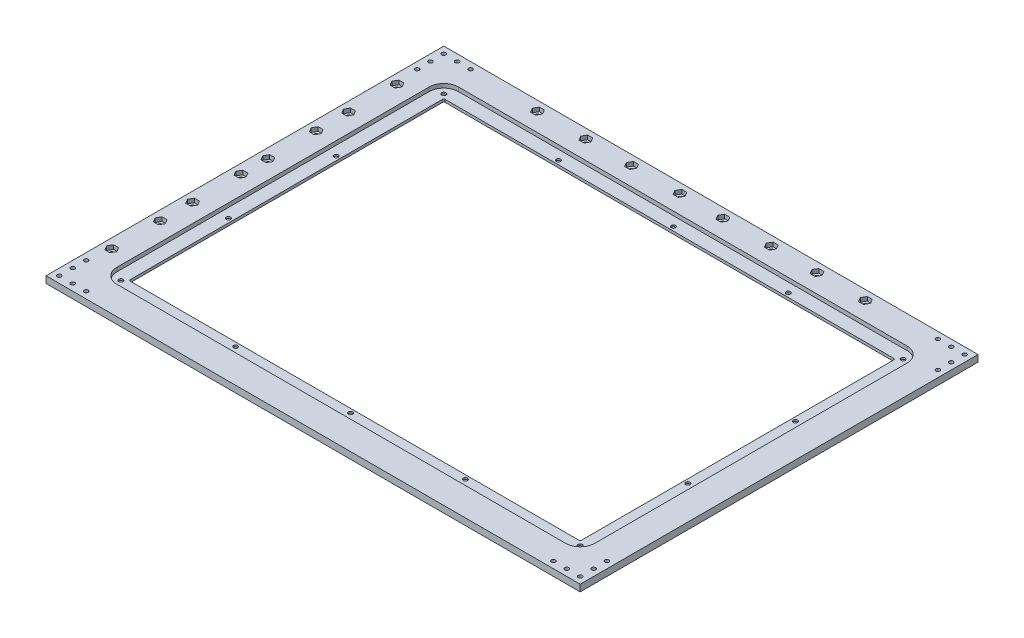
from build123d import *

# Parameters (mm, degrees)
SKETCH1_W           = 399.5
SKETCH1_H           = 297.5
BOSS_EXTRUDE1_DEPTH = 5
SKETCH2_R           = 1.6
CUT_EXTRUDE2_DEPTH  = 1.2
SKETCH3_R           = 1.5
CUT_EXTRUDE3_DEPTH  = 59.2
SKETCH4_R           = 1.5
CUT_EXTRUDE4_DEPTH  = 10.2
CUT_EXTRUDE5_DEPTH  = 3
CUT_EXTRUDE6_DEPTH  = 13
SKETCH9_R           = 1.6
CUT_EXTRUDE7_DEPTH  = 1.2
SKETCH11_R          = 1.6
CUT_EXTRUDE8_DEPTH  = 10
CUT_EXTRUDE9_DEPTH  = 3
CUT_EXTRUDE10_DEPTH = 3


with BuildPart() as part:
    # Sketch1 → Boss-Extrude1 (new body)
    with BuildSketch(Plane(origin=(0, 0, 0), x_dir=(1, 0, 0), z_dir=(0, 1, 0))):
        with Locations((199.75, 148.75)):
            Rectangle(SKETCH1_W, SKETCH1_H)
    extrude(amount=BOSS_EXTRUDE1_DEPTH)

    # Sketch2 → Cut-Extrude2 (cut)
    with BuildSketch(Plane.XZ):
        with Locations(Location((31, -5, 0), (0, 0, 270))):
            Circle(SKETCH2_R)
        with Locations(Location((10, -5, 0), (0, 0, 270))):
            Circle(SKETCH2_R)
        with Locations(Location((5, -10, 0), (0, 0, 270))):
            Circle(SKETCH2_R)
        with Locations(Location((5, -31, 0), (0, 0, 270))):
            Circle(SKETCH2_R)
        with Locations(Location((394.5, -31, 0), (0, 0, 90))):
            Circle(SKETCH2_R)
        with Locations(Location((394.5, -10, 0), (0, 0, 90))):
            Circle(SKETCH2_R)
        with Locations(Location((389.5, -5, 0), (0, 0, 90))):
            Circle(SKETCH2_R)
        with Locations(Location((368.5, -5, 0), (0, 0, 90))):
            Circle(SKETCH2_R)
        with Locations(Location((31, -292.5, 0), (0, 0, 90))):
            Circle(SKETCH2_R)
        with Locations(Location((10, -292.5, 0), (0, 0, 90))):
            Circle(SKETCH2_R)
        with Locations(Location((5, -287.5, 0), (0, 0, 90))):
            Circle(SKETCH2_R)
        with Locations(Location((5, -266.5, 0), (0, 0, 90))):
            Circle(SKETCH2_R)
        with Locations(Location((368.5, -292.5, 0), (0, 0, 270))):
            Circle(SKETCH2_R)
        with Locations(Location((389.5, -292.5, 0), (0, 0, 270))):
            Circle(SKETCH2_R)
        with Locations(Location((394.5, -287.5, 0), (0, 0, 270))):
            Circle(SKETCH2_R)
        with Locations(Location((394.5, -266.5, 0), (0, 0, 270))):
            Circle(SKETCH2_R)
    extrude(amount=-CUT_EXTRUDE2_DEPTH, mode=Mode.SUBTRACT)

    # Sketch3 → Cut-Extrude3 (cut)
    with BuildSketch(Plane.XZ):
        with Locations(Location((25, -5, 0), (0, 0, 270))):
            Circle(SKETCH3_R)
        with Locations(Location((15, -5, 0), (0, 0, 270))):
            Circle(SKETCH3_R)
        with Locations(Location((5, -15, 0), (0, 0, 270))):
            Circle(SKETCH3_R)
        with Locations(Location((5, -25, 0), (0, 0, 270))):
            Circle(SKETCH3_R)
        with Locations(Location((5, -272.5, 0), (0, 0, 270))):
            Circle(SKETCH3_R)
        with Locations(Location((5, -282.5, 0), (0, 0, 270))):
            Circle(SKETCH3_R)
        with Locations(Location((15, -292.5, 0), (0, 0, 270))):
            Circle(SKETCH3_R)
        with Locations(Location((25, -292.5, 0), (0, 0, 270))):
            Circle(SKETCH3_R)
        with Locations(Location((374.5, -5, 0), (0, 0, 270))):
            Circle(SKETCH3_R)
        with Locations(Location((384.5, -5, 0), (0, 0, 270))):
            Circle(SKETCH3_R)
        with Locations(Location((394.5, -15, 0), (0, 0, 270))):
            Circle(SKETCH3_R)
        with Locations(Location((394.5, -25, 0), (0, 0, 270))):
            Circle(SKETCH3_R)
        with Locations(Location((394.5, -272.5, 0), (0, 0, 270))):
            Circle(SKETCH3_R)
        with Locations(Location((394.5, -282.5, 0), (0, 0, 270))):
            Circle(SKETCH3_R)
        with Locations(Location((384.5, -292.5, 0), (0, 0, 270))):
            Circle(SKETCH3_R)
        with Locations(Location((374.5, -292.5, 0), (0, 0, 270))):
            Circle(SKETCH3_R)
    extrude(amount=-CUT_EXTRUDE3_DEPTH, mode=Mode.SUBTRACT)

    # Sketch4 → Cut-Extrude4 (cut)
    with BuildSketch(Plane(origin=(0, 5, 0), x_dir=(1, 0, 0), z_dir=(0, 1, 0))):
        with Locations(Location((5, 5, 0), (0, 0, 270))):
            Circle(SKETCH4_R)
        with Locations(Location((394.5, 292.5, 0), (0, 0, 270))):
            Circle(SKETCH4_R)
        with Locations(Location((394.5, 5, 0), (0, 0, 270))):
            Circle(SKETCH4_R)
        with Locations(Location((5, 292.5, 0), (0, 0, 270))):
            Circle(SKETCH4_R)
    extrude(amount=-CUT_EXTRUDE4_DEPTH, mode=Mode.SUBTRACT)

    # Sketch5 → Cut-Extrude5 (cut)
    with BuildSketch(Plane(origin=(0, 5, 0), x_dir=(1, 0, 0), z_dir=(0, 1, 0))):
        with BuildLine():
            Line((32, 276.5), (367.5, 276.5))
            ThreePointArc((367.5, 276.5), (375.278174593, 273.278174593), (378.5, 265.5))
            Line((378.5, 265.5), (378.5, 32))
            ThreePointArc((378.5, 32), (375.278174593, 24.221825407), (367.5, 21))
            Line((367.5, 21), (32, 21))
            ThreePointArc((32, 21), (24.221825407, 24.221825407), (21, 32))
            Line((21, 32), (21, 265.5))
            ThreePointArc((21, 265.5), (24.221825407, 273.278174593), (32, 276.5))
        make_face()
    extrude(amount=-CUT_EXTRUDE5_DEPTH, mode=Mode.SUBTRACT)

    # Sketch6 → Cut-Extrude6 (cut)
    with BuildSketch(Plane(origin=(0, 2, 0), x_dir=(1, 0, 0), z_dir=(0, 1, 0))):
        with BuildLine():
            Line((368.5, 32), (368.5, 265.5))
            ThreePointArc((368.5, 265.5), (368.207106781, 266.207106781), (367.5, 266.5))
            Line((367.5, 266.5), (32, 266.5))
            ThreePointArc((32, 266.5), (31.292893219, 266.207106781), (31, 265.5))
            Line((31, 265.5), (31, 32))
            ThreePointArc((31, 32), (31.292893219, 31.292893219), (32, 31))
            Line((32, 31), (367.5, 31))
            ThreePointArc((367.5, 31), (368.207106781, 31.292893219), (368.5, 32))
        make_face()
    extrude(amount=-CUT_EXTRUDE6_DEPTH, mode=Mode.SUBTRACT)

    # Sketch9 → Cut-Extrude7 (cut)
    with BuildSketch(Plane(origin=(0, 2, 0), x_dir=(1, 0, 0), z_dir=(0, 1, 0))):
        with Locations(Location((199.75, 28, 0), (0, 0, 270))):
            Circle(SKETCH9_R)
        with Locations(Location((285.625, 28, 0), (0, 0, 270))):
            Circle(SKETCH9_R)
        with Locations(Location((371.5, 28, 0), (0, 0, 270))):
            Circle(SKETCH9_R)
        with Locations(Location((371.5, 108.5, 0), (0, 0, 270))):
            Circle(SKETCH9_R)
        with Locations(Location((371.5, 189, 0), (0, 0, 270))):
            Circle(SKETCH9_R)
        with Locations(Location((113.875, 28, 0), (0, 0, 270))):
            Circle(SKETCH9_R)
        with Locations(Location((28, 28, 0), (0, 0, 270))):
            Circle(SKETCH9_R)
        with Locations(Location((28, 108.5, 0), (0, 0, 270))):
            Circle(SKETCH9_R)
        with Locations(Location((28, 189, 0), (0, 0, 270))):
            Circle(SKETCH9_R)
        with Locations(Location((28, 269.5, 0), (0, 0, 270))):
            Circle(SKETCH9_R)
        with Locations(Location((113.875, 269.5, 0), (0, 0, 270))):
            Circle(SKETCH9_R)
        with Locations(Location((199.75, 269.5, 0), (0, 0, 270))):
            Circle(SKETCH9_R)
        with Locations(Location((285.625, 269.5, 0), (0, 0, 270))):
            Circle(SKETCH9_R)
        with Locations(Location((371.5, 269.5, 0), (0, 0, 270))):
            Circle(SKETCH9_R)
    extrude(amount=-CUT_EXTRUDE7_DEPTH, mode=Mode.SUBTRACT)

    # Sketch11 → Cut-Extrude8 (cut)
    with BuildSketch(Plane.XZ):
        with Locations(Location((286.2, -290.4, 0), (0, 0, 270))):
            Circle(SKETCH11_R)
        with Locations(Location((322.4, -290.4, 0), (0, 0, 270))):
            Circle(SKETCH11_R)
        with Locations(Location((252, -290.4, 0), (0, 0, 270))):
            Circle(SKETCH11_R)
        with Locations(Location((215.8, -290.4, 0), (0, 0, 270))):
            Circle(SKETCH11_R)
        with Locations(Location((183.7, -290.4, 0), (0, 0, 270))):
            Circle(SKETCH11_R)
        with Locations(Location((147.5, -290.4, 0), (0, 0, 270))):
            Circle(SKETCH11_R)
        with Locations(Location((113.3, -290.4, 0), (0, 0, 270))):
            Circle(SKETCH11_R)
        with Locations(Location((77.1, -290.4, 0), (0, 0, 270))):
            Circle(SKETCH11_R)
        with Locations(Location((7.1, -255.4, 0), (0, 0, 270))):
            Circle(SKETCH11_R)
        with Locations(Location((7.1, -219.2, 0), (0, 0, 270))):
            Circle(SKETCH11_R)
        with Locations(Location((7.1, -195, 0), (0, 0, 270))):
            Circle(SKETCH11_R)
        with Locations(Location((7.1, -158.8, 0), (0, 0, 270))):
            Circle(SKETCH11_R)
        with Locations(Location((7.1, -138.7, 0), (0, 0, 270))):
            Circle(SKETCH11_R)
        with Locations(Location((7.1, -102.5, 0), (0, 0, 270))):
            Circle(SKETCH11_R)
        with Locations(Location((7.1, -78.3, 0), (0, 0, 270))):
            Circle(SKETCH11_R)
        with Locations(Location((7.1, -42.1, 0), (0, 0, 270))):
            Circle(SKETCH11_R)
    extrude(amount=-CUT_EXTRUDE8_DEPTH, mode=Mode.SUBTRACT)

    # Sketch12 → Cut-Extrude9 (cut)
    with BuildSketch(Plane(origin=(0, 5, 0), x_dir=(1, 0, 0), z_dir=(0, 1, 0))):
        Polygon((326.19, 290.4), (324.295, 293.68223628), (320.505, 293.68223628), (318.61, 290.4), (320.505, 287.11776372), (324.295, 287.11776372), align=None)
        Polygon((289.99, 290.4), (288.095, 293.68223628), (284.305, 293.68223628), (282.41, 290.4), (284.305, 287.11776372), (288.095, 287.11776372), align=None)
        Polygon((248.21, 290.4), (250.105, 287.11776372), (253.895, 287.11776372), (255.79, 290.4), (253.895, 293.68223628), (250.105, 293.68223628), align=None)
        Polygon((212.01, 290.4), (213.905, 287.11776372), (217.695, 287.11776372), (219.59, 290.4), (217.695, 293.68223628), (213.905, 293.68223628), align=None)
        Polygon((179.91, 290.4), (181.805, 287.11776372), (185.595, 287.11776372), (187.49, 290.4), (185.595, 293.68223628), (181.805, 293.68223628), align=None)
        Polygon((143.71, 290.4), (145.605, 287.11776372), (149.395, 287.11776372), (151.29, 290.4), (149.395, 293.68223628), (145.605, 293.68223628), align=None)
        Polygon((109.51, 290.4), (111.405, 287.11776372), (115.195, 287.11776372), (117.09, 290.4), (115.195, 293.68223628), (111.405, 293.68223628), align=None)
        Polygon((73.31, 290.4), (75.205, 287.11776372), (78.995, 287.11776372), (80.89, 290.4), (78.995, 293.68223628), (75.205, 293.68223628), align=None)
    extrude(amount=-CUT_EXTRUDE9_DEPTH, mode=Mode.SUBTRACT)

    # Sketch13 → Cut-Extrude10 (cut)
    with BuildSketch(Plane(origin=(0, 5, 0), x_dir=(1, 0, 0), z_dir=(0, 1, 0))):
        Polygon((10.89, 255.4), (8.995, 258.68223628), (5.205, 258.68223628), (3.31, 255.4), (5.205, 252.11776372), (8.995, 252.11776372), align=None)
        Polygon((10.89, 219.2), (8.995, 222.48223628), (5.205, 222.48223628), (3.31, 219.2), (5.205, 215.91776372), (8.995, 215.91776372), align=None)
        Polygon((10.89, 195), (8.995, 198.28223628), (5.205, 198.28223628), (3.31, 195), (5.205, 191.71776372), (8.995, 191.71776372), align=None)
        Polygon((10.89, 158.8), (8.995, 162.08223628), (5.205, 162.08223628), (3.31, 158.8), (5.205, 155.51776372), (8.995, 155.51776372), align=None)
        Polygon((10.89, 138.7), (8.995, 141.98223628), (5.205, 141.98223628), (3.31, 138.7), (5.205, 135.41776372), (8.995, 135.41776372), align=None)
        Polygon((10.89, 102.5), (8.995, 105.78223628), (5.205, 105.78223628), (3.31, 102.5), (5.205, 99.21776372), (8.995, 99.21776372), align=None)
        Polygon((10.89, 78.3), (8.995, 81.58223628), (5.205, 81.58223628), (3.31, 78.3), (5.205, 75.01776372), (8.995, 75.01776372), align=None)
        Polygon((10.89, 42.1), (8.995, 45.38223628), (5.205, 45.38223628), (3.31, 42.1), (5.205, 38.81776372), (8.995, 38.81776372), align=None)
    extrude(amount=-CUT_EXTRUDE10_DEPTH, mode=Mode.SUBTRACT)


solid = part.part
